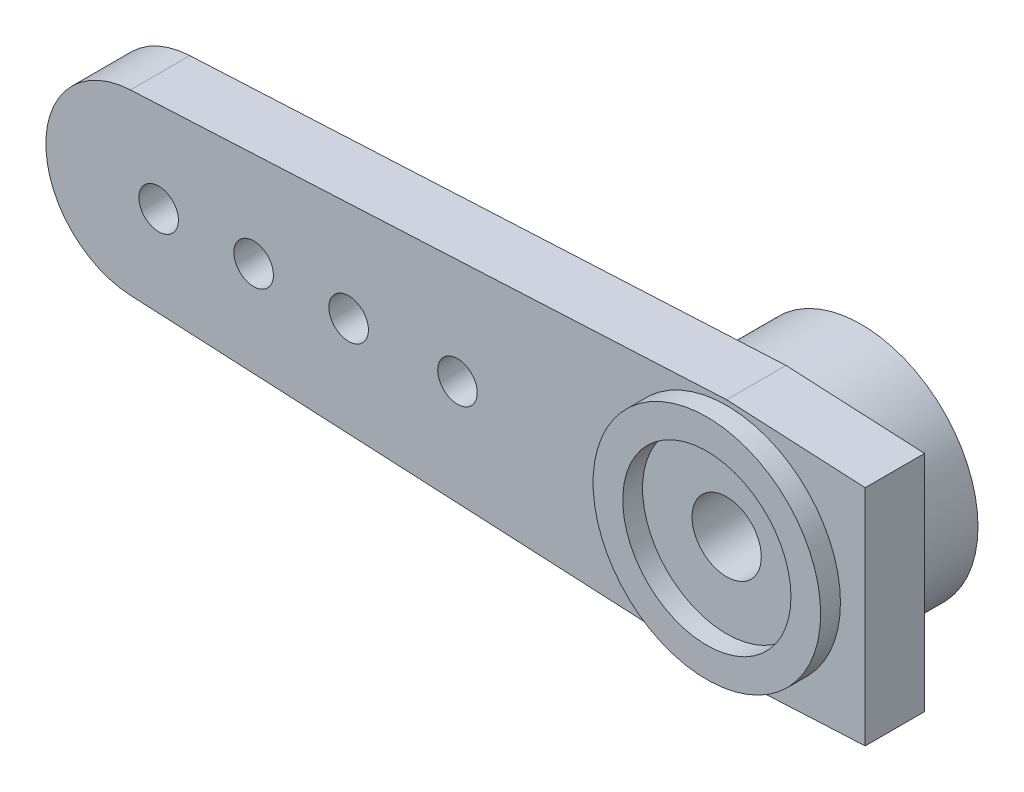
from build123d import *

# Parameters (mm, degrees)
SKETCH1_R           = 2.95
SKETCH1_R_2         = 2.25
BOSS_EXTRUDE1_DEPTH = 1.9
SKETCH2_R           = 0.875
SKETCH2_R_2         = 0.5
BOSS_EXTRUDE2_DEPTH = 1.5
SKETCH3_R           = 2.875
SKETCH3_R_2         = 2.125
BOSS_EXTRUDE3_DEPTH = 0.5
CUT_EXTRUDE1_START  = -10
CUT_EXTRUDE1_DEPTH  = 10


with BuildPart() as part:
    # Sketch1 → Boss-Extrude1 (new body)
    with BuildSketch(Plane.XY):
        with Locations(Location((0, 0, 0), (0, 0, 180))):
            Circle(SKETCH1_R)
        with Locations(Location((0, 0, 0), (0, 0, 180))):
            Circle(SKETCH1_R_2, mode=Mode.SUBTRACT)
    extrude(amount=BOSS_EXTRUDE1_DEPTH)

    # Sketch2 → Boss-Extrude2 (add)
    with BuildSketch(Plane.XY.offset(1.9)):
        with BuildLine():
            Line((15.062313393, 2.247195074), (0, 3))
            Line((0, 3), (-15.062313393, 2.247195074))
            ThreePointArc((-15.062313393, 2.247195074), (-17.2, 0), (-15.062313393, -2.247195074))
            Line((-15.062313393, -2.247195074), (0, -3))
            Line((0, -3), (15.062313393, -2.247195074))
            ThreePointArc((15.062313393, -2.247195074), (17.2, 0), (15.062313393, 2.247195074))
        make_face()
        Circle(SKETCH2_R, mode=Mode.SUBTRACT)
        with Locations((6.8, 0)):
            Circle(SKETCH2_R_2, mode=Mode.SUBTRACT)
        with Locations((9.55, 0)):
            Circle(SKETCH2_R_2, mode=Mode.SUBTRACT)
        with Locations((11.95, 0)):
            Circle(SKETCH2_R_2, mode=Mode.SUBTRACT)
        with Locations((14.35, 0)):
            Circle(SKETCH2_R_2, mode=Mode.SUBTRACT)
        with Locations(Location((-14.35, 0, 0), (0, 0, 180))):
            Circle(SKETCH2_R_2, mode=Mode.SUBTRACT)
        with Locations(Location((-11.95, 0, 0), (0, 0, 180))):
            Circle(SKETCH2_R_2, mode=Mode.SUBTRACT)
        with Locations(Location((-9.55, 0, 0), (0, 0, 180))):
            Circle(SKETCH2_R_2, mode=Mode.SUBTRACT)
        with Locations(Location((-6.8, 0, 0), (0, 0, 180))):
            Circle(SKETCH2_R_2, mode=Mode.SUBTRACT)
    extrude(amount=BOSS_EXTRUDE2_DEPTH)

    # Sketch3 → Boss-Extrude3 (add)
    with BuildSketch(Plane.XY.offset(3.4)):
        Circle(SKETCH3_R)
        Circle(SKETCH3_R_2, mode=Mode.SUBTRACT)
    extrude(amount=BOSS_EXTRUDE3_DEPTH)

    # Sketch4 → Cut-Extrude1 (cut)
    with BuildSketch(Plane.XY.offset(3.4).offset(CUT_EXTRUDE1_START)):
        with BuildLine():
            Line((3.5, 2.825072207), (3.5, -2.825072207))
            Line((3.5, -2.825072207), (15.062313393, -2.247195074))
            ThreePointArc((15.062313393, -2.247195074), (17.2, 0), (15.062313393, 2.247195074))
            Line((15.062313393, 2.247195074), (3.5, 2.825072207))
        make_face()
    extrude(amount=CUT_EXTRUDE1_DEPTH, mode=Mode.SUBTRACT)


solid = part.part
